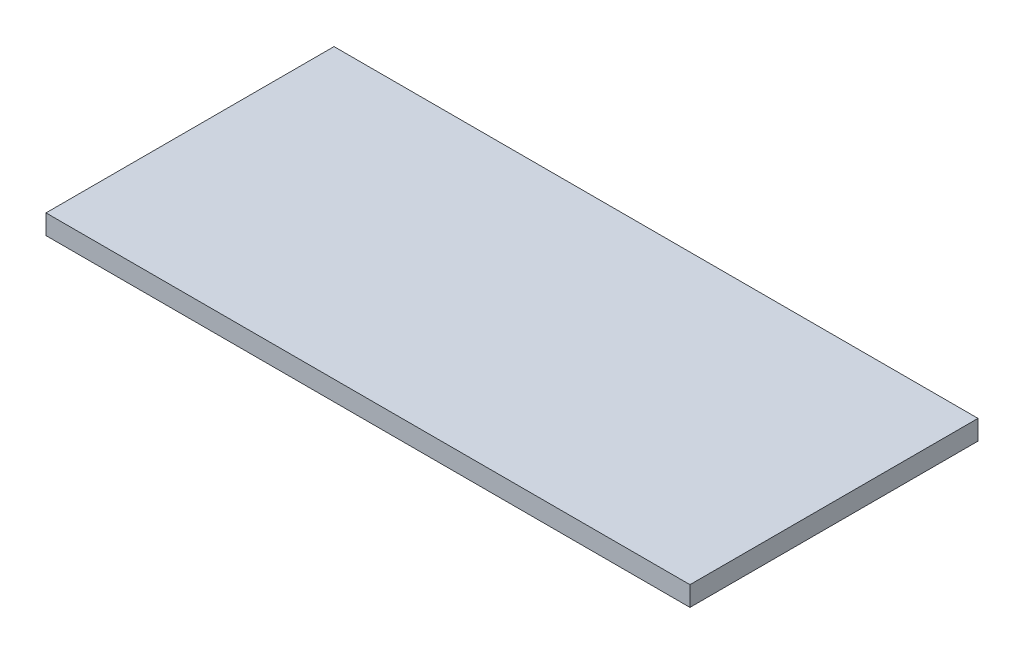
from build123d import *

# Parameters (mm, degrees)
SKETCH1_W           = 588
SKETCH1_H           = 263
BOSS_EXTRUDE1_DEPTH = 18


with BuildPart() as part:
    # Sketch1 → Boss-Extrude1 (new body)
    with BuildSketch(Plane(origin=(0, 0, 0), x_dir=(1, 0, 0), z_dir=(0, 1, 0))):
        with Locations((294, 131.5)):
            Rectangle(SKETCH1_W, SKETCH1_H)
    extrude(amount=BOSS_EXTRUDE1_DEPTH)


solid = part.part
